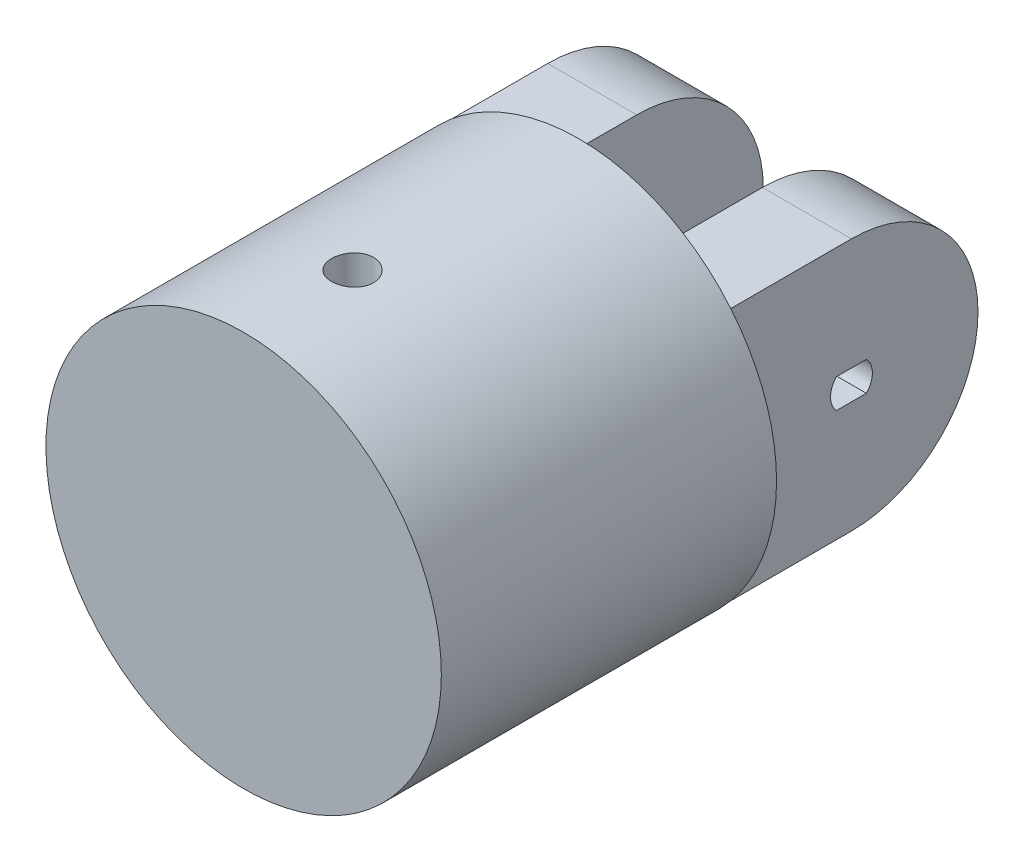
from build123d import *

# Parameters (mm, degrees)
RESSALTO_EXTRUS_O1_DEPTH      = 10
RESSALTO_EXTRUS_O1_DEPTH_BACK = 30
ESBO_O1_R                     = 23.59
RESSALTO_EXTRUS_O2_DEPTH      = 30
CORTE_EXTRUS_O1_DEPTH         = 59.405
CORTE_EXTRUS_O2_DEPTH         = 79.405
SKETCH2_R                     = 2.5
CUT_EXTRUDE1_DEPTH            = 80.519934634


with BuildPart() as part:
    # Esboço1 → Ressalto-extrusão1 (new, two sides: drawn at the far end of the back side and taken through both)
    with BuildSketch(Plane.XY.offset(-RESSALTO_EXTRUS_O1_DEPTH_BACK)):
        Circle(ESBO_O1_R)
    extrude(amount=RESSALTO_EXTRUS_O1_DEPTH + RESSALTO_EXTRUS_O1_DEPTH_BACK)

    # Esboço2 → Ressalto-extrusão2 (add)
    with BuildSketch(Plane(origin=(0, 0, -30), x_dir=(-1, 0, 0), z_dir=(0, 0, -1))):
        Polygon((-7.5, -15.101129972), (-7.5, 0), (-7.5, 15.101129972), (-18.123023301, 15.101129972), (-18.123023301, -15.101129972), align=None)
        Polygon((7.5, -15.101129972), (7.5, 0), (7.5, 15.101129972), (18.123023301, 15.101129972), (18.123023301, -15.101129972), align=None)
    extrude(amount=RESSALTO_EXTRUS_O2_DEPTH)

    # Esboço3 → Corte-extrusão1 (cut, symmetric)
    with BuildSketch(Plane.ZY.offset(18.123023301)):
        with BuildLine():
            Line((-44.405, 18.172432148), (-62.563044424, 18.172432148))
            Line((-62.563044424, 18.172432148), (-62.563044424, -18.251867877))
            Line((-62.563044424, -18.251867877), (-44.405, -18.251867877))
            Line((-44.405, -18.251867877), (-44.405, -15.101129972))
            ThreePointArc((-44.405, -15.101129972), (-59.506129972, 0), (-44.405, 15.101129972))
            Line((-44.405, 15.101129972), (-44.405, 18.172432148))
        make_face()
    extrude(amount=CORTE_EXTRUS_O1_DEPTH, both=True, mode=Mode.SUBTRACT)

    # Esboço4 → Corte-extrusão2 (cut, symmetric)
    with BuildSketch(Plane.ZY.offset(18.123023301)):
        with BuildLine():
            Line((-46.190357107, 1.75), (-42.619642893, 1.75))
            ThreePointArc((-42.619642893, 1.75), (-41.905, 0), (-42.619642893, -1.75))
            Line((-42.619642893, -1.75), (-46.190357107, -1.75))
            ThreePointArc((-46.190357107, -1.75), (-46.905, 0), (-46.190357107, 1.75))
        make_face()
    extrude(amount=CORTE_EXTRUS_O2_DEPTH, both=True, mode=Mode.SUBTRACT)

    # Sketch2 → Cut-Extrude1 (cut, through all)
    with BuildSketch(Plane(origin=(0, 23.59, 0), x_dir=(1, 0, 0), z_dir=(0, 1, 0))):
        with Locations(Location((0, 2.99, 0), (0, 0, 270))):
            Circle(SKETCH2_R)
    extrude(amount=-CUT_EXTRUDE1_DEPTH, mode=Mode.SUBTRACT)


solid = part.part
